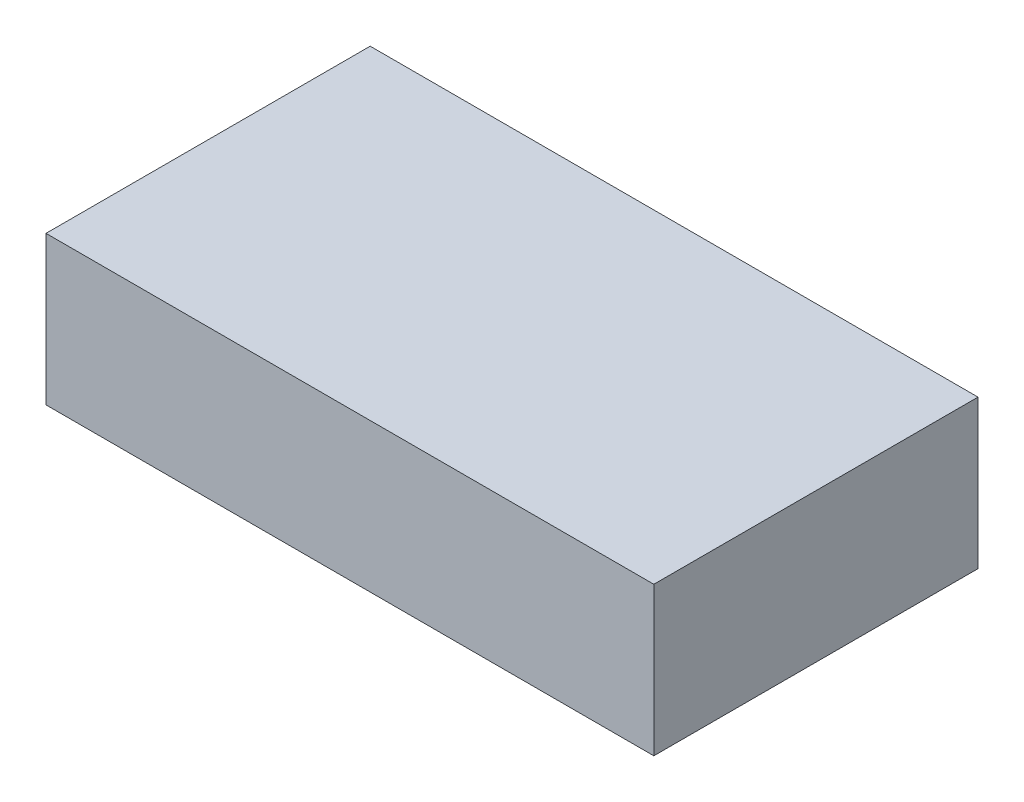
from build123d import *

# Parameters (mm, degrees)
SKETCH1_W           = 45
SKETCH1_H           = 24.000000006
BOSS_EXTRUDE1_DEPTH = 11


with BuildPart() as part:
    # Sketch1 → Boss-Extrude1 (new body)
    with BuildSketch(Plane(origin=(0, 0, 0), x_dir=(1, 0, 0), z_dir=(0, 1, 0))):
        with Locations((-22.5, 12.000000003)):
            Rectangle(SKETCH1_W, SKETCH1_H)
    extrude(amount=BOSS_EXTRUDE1_DEPTH)


solid = part.part
